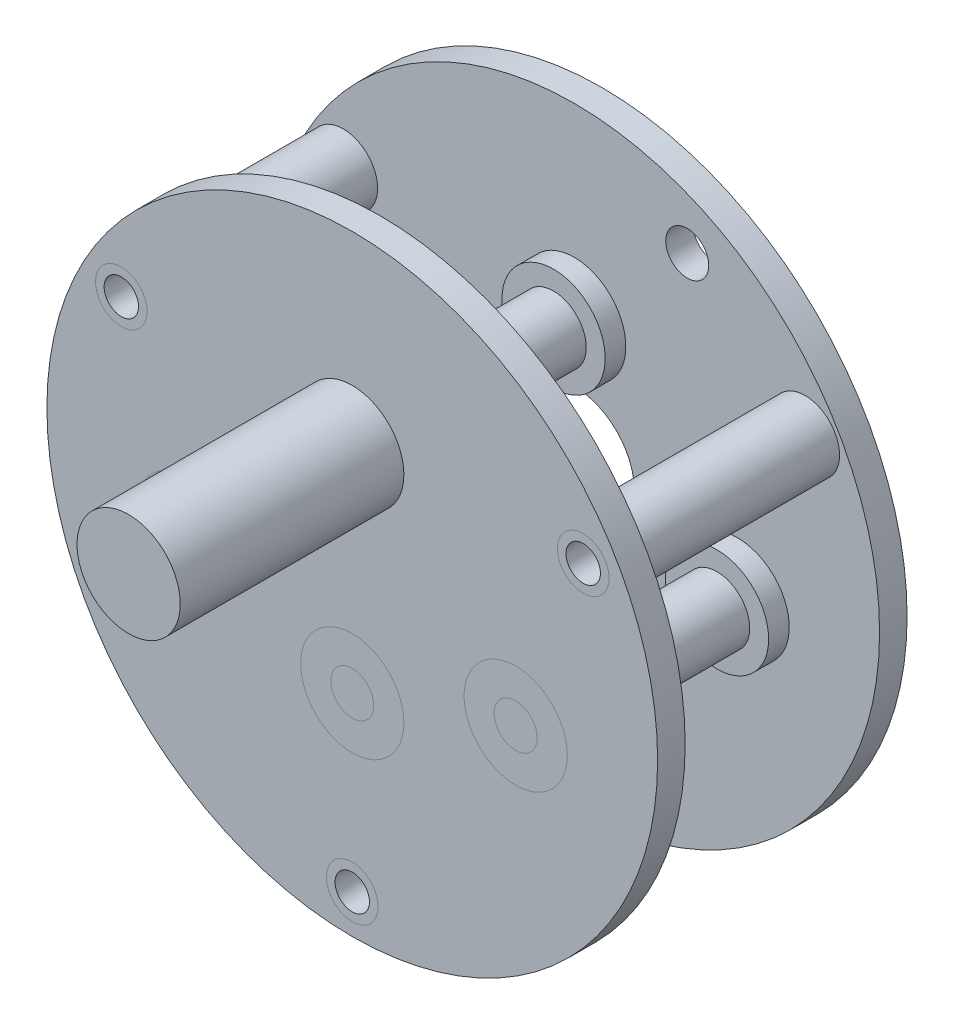
from build123d import *

# Parameters (mm, degrees)
SKETCH_1_R          = 17.75
EXTRUDE_1_DEPTH     = 1.6
SKETCH_2_R          = 2
EXTRUDE_2_DEPTH     = 11.3
EXTRUDE_START       = 1.6
SKETCH_3_R          = 17.75
EXTRUDE_3_DEPTH     = 1.6
CUT_EXTRUDE_2_REACH = 30.989
SKETCH_5_R          = 3.5
SKETCH_5_R_2        = 1
SKETCH_6_R          = 6
EXTRUDE_4_DEPTH     = 10
SKETCH_7_R          = 3
EXTRUDE_5_DEPTH     = 15
CHAMFER_1_SIZE      = 0.5
CUT_EXTRUDE_START   = -12
CUT_EXTRUDE_3_DEPTH = 12
SKETCH_10_R         = 3
EXTRUDE_6_DEPTH     = 2.8
EXTRUDE_7_REACH     = 39.456
SKETCH_13_R         = 1.9
CUT_EXTRUDE_4_REACH = 48.801
CUT_EXTRUDE_5_REACH = 48.801
SKETCH_17_R         = 1.25
CHAMFER_2_SIZE      = 0.5
EXTRUDE_START_2     = 1.2
SKETCH_19_R         = 3
EXTRUDE_8_DEPTH     = 1.2
EXTRUDE_9_REACH     = 39.456
SKETCH_20_R         = 1.9
SKETCH_21_R         = 3
EXTRUDE_10_DEPTH    = 1.2
CUT_EXTRUDE_START_2 = -10
SKETCH_22_R         = 6
SKETCH_22_R_2       = 3
CUT_EXTRUDE_6_DEPTH = 10
SKETCH_24_R         = 3
CUT_EXTRUDE_8_DEPTH = 12


with BuildPart() as part:
    # ｽｹｯﾁ1 → ﾎﾞｽ - 押し出し1 (new body)
    with BuildSketch(Plane.XY):
        Circle(SKETCH_1_R)
    extrude(amount=EXTRUDE_1_DEPTH)

    # ｽｹｯﾁ2 → ﾎﾞｽ - 押し出し2 (add)
    with BuildSketch(Plane(origin=(0, 0, 0), x_dir=(-1, 0, 0), z_dir=(0, 0, -1))):
        with Locations(Location((0, -15.5, 0), (0, 0, 180))):
            Circle(SKETCH_2_R)
        with Locations(Location((-13.423393759, 7.75, 0), (0, 0, 180))):
            Circle(SKETCH_2_R)
        with Locations(Location((13.423393759, 7.75, 0), (0, 0, 180))):
            Circle(SKETCH_2_R)
    extrude(amount=EXTRUDE_2_DEPTH)

    # ｽｹｯﾁ3 → ﾎﾞｽ - 押し出し3 (add)
    with BuildSketch(Plane(origin=(0, 0, -11.3), x_dir=(-1, 0, 0), z_dir=(0, 0, -1)).offset(EXTRUDE_START)):
        with Locations(Location((0, 0, 0), (0, 0, 180))):
            Circle(SKETCH_3_R)
    extrude(amount=-EXTRUDE_3_DEPTH)

    # ｽｹｯﾁ5 → ｶｯﾄ - 押し出し2 (cut, up to next)
    with BuildSketch(Plane(origin=(0, 0, -12.9), x_dir=(-1, 0, 0), z_dir=(0, 0, -1)), mode=Mode.PRIVATE) as cut_extrude_2_sk1:
        Circle(SKETCH_5_R)
    cut_extrude_2_tool1 = extrude(cut_extrude_2_sk1.sketch, amount=-CUT_EXTRUDE_2_REACH, mode=Mode.PRIVATE) & part.part
    # ｽｹｯﾁ5 → ｶｯﾄ - 押し出し2 (cut, up to next)
    with BuildSketch(Plane(origin=(0, 0, -12.9), x_dir=(-1, 0, 0), z_dir=(0, 0, -1)), mode=Mode.PRIVATE) as cut_extrude_2_sk2:
        with Locations((-13.423393759, 7.75)):
            Circle(SKETCH_5_R_2)
    cut_extrude_2_tool2 = extrude(cut_extrude_2_sk2.sketch, amount=-CUT_EXTRUDE_2_REACH, mode=Mode.PRIVATE) & part.part
    # ｽｹｯﾁ5 → ｶｯﾄ - 押し出し2 (cut, up to next)
    with BuildSketch(Plane(origin=(0, 0, -12.9), x_dir=(-1, 0, 0), z_dir=(0, 0, -1)), mode=Mode.PRIVATE) as cut_extrude_2_sk3:
        with Locations((13.423393759, 7.75)):
            Circle(SKETCH_5_R_2)
    cut_extrude_2_tool3 = extrude(cut_extrude_2_sk3.sketch, amount=-CUT_EXTRUDE_2_REACH, mode=Mode.PRIVATE) & part.part
    # ｽｹｯﾁ5 → ｶｯﾄ - 押し出し2 (cut, up to next)
    with BuildSketch(Plane(origin=(0, 0, -12.9), x_dir=(-1, 0, 0), z_dir=(0, 0, -1)), mode=Mode.PRIVATE) as cut_extrude_2_sk4:
        with Locations((0, -15.5)):
            Circle(SKETCH_5_R_2)
    cut_extrude_2_tool4 = extrude(cut_extrude_2_sk4.sketch, amount=-CUT_EXTRUDE_2_REACH, mode=Mode.PRIVATE) & part.part
    add(cut_extrude_2_tool1.solids().sort_by_distance((0, 0, -12.9))[0], mode=Mode.SUBTRACT)
    add(cut_extrude_2_tool2.solids().sort_by_distance((13.423394, 7.75, -12.9))[0], mode=Mode.SUBTRACT)
    add(cut_extrude_2_tool3.solids().sort_by_distance((-13.423394, 7.75, -12.9))[0], mode=Mode.SUBTRACT)
    add(cut_extrude_2_tool4.solids().sort_by_distance((0, -15.5, -12.9))[0], mode=Mode.SUBTRACT)

    # ｽｹｯﾁ6 → ﾎﾞｽ - 押し出し4 (add)
    with BuildSketch(Plane.XY.offset(1.6)):
        with Locations((0, 7)):
            Circle(SKETCH_6_R)
    extrude(amount=EXTRUDE_4_DEPTH)

    # ｽｹｯﾁ7 → ﾎﾞｽ - 押し出し5 (add)
    with BuildSketch(Plane.XY.offset(11.6)):
        with Locations((0, 7)):
            Circle(SKETCH_7_R)
    extrude(amount=EXTRUDE_5_DEPTH)

    # 面取り1
    chamfer_1_edges = [part.edges().sort_by_distance(p)[0] for p in [
        (-3, 7, 26.6),
    ]]
    chamfer(chamfer_1_edges, length=CHAMFER_1_SIZE)

    # ｽｹｯﾁ8 → ｶｯﾄ - 押し出し3 (cut)
    with BuildSketch(Plane.XY.offset(26.6).offset(CUT_EXTRUDE_START)):
        with BuildLine():
            Line((1.658312395, 9.5), (-1.658312395, 9.5))
            ThreePointArc((-1.658312395, 9.5), (0, 10), (1.658312395, 9.5))
        make_face()
    extrude(amount=CUT_EXTRUDE_3_DEPTH, mode=Mode.SUBTRACT)

    # ｽｹｯﾁ10 → ﾎﾞｽ - 押し出し6 (add)
    with BuildSketch(Plane.XY.offset(1.6)):
        with Locations((0, -5.5)):
            Circle(SKETCH_10_R)
        with Locations((9.5, -2.377501001)):
            Circle(SKETCH_10_R)
        with Locations((-9.5, -2.377501001)):
            Circle(SKETCH_10_R)
    extrude_6 = extrude(amount=-EXTRUDE_6_DEPTH)

    # ﾐﾗｰ1: ﾎﾞｽ - 押し出し6 across plane
    add(extrude_6.mirror(Plane.XY.offset(-5.65)))

    # ｽｹｯﾁ13 → ﾎﾞｽ - 押し出し7 (add, up to next)
    with BuildSketch(Plane(origin=(0, 0, -1.2), x_dir=(-1, 0, 0), z_dir=(0, 0, -1)), mode=Mode.PRIVATE) as extrude_7_sk1:
        with Locations(Location((-9.5, -2.377501001, 0), (0, 0, 180))):
            Circle(SKETCH_13_R)
    extrude_7_tool1 = extrude(extrude_7_sk1.sketch, amount=EXTRUDE_7_REACH, mode=Mode.PRIVATE) - part.part
    # ｽｹｯﾁ13 → ﾎﾞｽ - 押し出し7 (add, up to next)
    with BuildSketch(Plane(origin=(0, 0, -1.2), x_dir=(-1, 0, 0), z_dir=(0, 0, -1)), mode=Mode.PRIVATE) as extrude_7_sk2:
        with Locations(Location((0, -5.5, 0), (0, 0, 180))):
            Circle(SKETCH_13_R)
    extrude_7_tool2 = extrude(extrude_7_sk2.sketch, amount=EXTRUDE_7_REACH, mode=Mode.PRIVATE) - part.part
    # ｽｹｯﾁ13 → ﾎﾞｽ - 押し出し7 (add, up to next)
    with BuildSketch(Plane(origin=(0, 0, -1.2), x_dir=(-1, 0, 0), z_dir=(0, 0, -1)), mode=Mode.PRIVATE) as extrude_7_sk3:
        with Locations(Location((9.5, -2.377501001, 0), (0, 0, 180))):
            Circle(SKETCH_13_R)
    extrude_7_tool3 = extrude(extrude_7_sk3.sketch, amount=EXTRUDE_7_REACH, mode=Mode.PRIVATE) - part.part
    add(extrude_7_tool1.solids().sort_by_distance((9.5, -2.377501, -1.2))[0])
    add(extrude_7_tool2.solids().sort_by_distance((0, -5.5, -1.2))[0])
    add(extrude_7_tool3.solids().sort_by_distance((-9.5, -2.377501, -1.2))[0])

    # ｽｹｯﾁ15 → ｶｯﾄ - 押し出し4 (cut, up to next)
    with BuildSketch(Plane(origin=(0, 0, -12.9), x_dir=(-1, 0, 0), z_dir=(0, 0, -1)), mode=Mode.PRIVATE) as cut_extrude_4_sk1:
        with BuildLine():
            Line((2.236067977, -3.5), (-2.236067977, -3.5))
            ThreePointArc((-2.236067977, -3.5), (-1.99347124, -3.258109634), (-1.724878724, -3.045454545))
            ThreePointArc((-1.724878724, -3.045454545), (0, -2.5), (1.724878724, -3.045454545))
            ThreePointArc((1.724878724, -3.045454545), (1.99347124, -3.258109634), (2.236067977, -3.5))
        make_face()
    cut_extrude_4_tool1 = extrude(cut_extrude_4_sk1.sketch, amount=-CUT_EXTRUDE_4_REACH, mode=Mode.PRIVATE) & part.part
    add(cut_extrude_4_tool1.solids().sort_by_distance((0, -3.093671, -12.9))[0], mode=Mode.SUBTRACT)

    # ｽｹｯﾁ17 → ｶｯﾄ - 押し出し5 (cut, up to next)
    with BuildSketch(Plane(origin=(0, 0, -12.9), x_dir=(-1, 0, 0), z_dir=(0, 0, -1)), mode=Mode.PRIVATE) as cut_extrude_5_sk1:
        with Locations((-6.569553896, 13.48484192)):
            Circle(SKETCH_17_R)
    cut_extrude_5_tool1 = extrude(cut_extrude_5_sk1.sketch, amount=-CUT_EXTRUDE_5_REACH, mode=Mode.PRIVATE) & part.part
    # ｽｹｯﾁ17 → ｶｯﾄ - 押し出し5 (cut, up to next)
    with BuildSketch(Plane(origin=(0, 0, -12.9), x_dir=(-1, 0, 0), z_dir=(0, 0, -1)), mode=Mode.PRIVATE) as cut_extrude_5_sk2:
        with Locations((6.569553896, -13.48484192)):
            Circle(SKETCH_17_R)
    cut_extrude_5_tool2 = extrude(cut_extrude_5_sk2.sketch, amount=-CUT_EXTRUDE_5_REACH, mode=Mode.PRIVATE) & part.part
    add(cut_extrude_5_tool1.solids().sort_by_distance((6.569554, 13.484842, -12.9))[0], mode=Mode.SUBTRACT)
    add(cut_extrude_5_tool2.solids().sort_by_distance((-6.569554, -13.484842, -12.9))[0], mode=Mode.SUBTRACT)

    # 面取り2
    chamfer_2_edges = [part.edges().sort_by_distance(p)[0] for p in [
        (-6, 7, 11.6),
    ]]
    chamfer(chamfer_2_edges, length=CHAMFER_2_SIZE)

    # ｽｹｯﾁ19 → ﾎﾞｽ - 押し出し8 (add)
    with BuildSketch(Plane(origin=(0, 0, 0), x_dir=(-1, 0, 0), z_dir=(0, 0, -1)).offset(EXTRUDE_START_2)):
        with Locations(Location((0, 7, 0), (0, 0, 56.442690238))):
            Circle(SKETCH_19_R)
    extrude(amount=-EXTRUDE_8_DEPTH)

    # ｽｹｯﾁ20 → ﾎﾞｽ - 押し出し9 (add, up to next)
    with BuildSketch(Plane(origin=(0, 0, -1.2), x_dir=(-1, 0, 0), z_dir=(0, 0, -1)), mode=Mode.PRIVATE) as extrude_9_sk1:
        with Locations(Location((0, 7, 0), (0, 0, 180))):
            Circle(SKETCH_20_R)
    extrude_9_tool1 = extrude(extrude_9_sk1.sketch, amount=EXTRUDE_9_REACH, mode=Mode.PRIVATE) - part.part
    add(extrude_9_tool1.solids().sort_by_distance((0, 7, -1.2))[0])

    # ｽｹｯﾁ21 → ﾎﾞｽ - 押し出し10 (add)
    with BuildSketch(Plane.XY.offset(-11.3)):
        with Locations(Location((0, 7, 0), (0, 0, 123.557309762))):
            Circle(SKETCH_21_R)
    extrude(amount=EXTRUDE_10_DEPTH)

    # ｽｹｯﾁ22 → ｶｯﾄ - 押し出し6 (cut)
    with BuildSketch(Plane.XY.offset(11.6).offset(CUT_EXTRUDE_START_2)):
        with Locations((0, 7)):
            Circle(SKETCH_22_R)
        with Locations((0, 7)):
            Circle(SKETCH_22_R_2, mode=Mode.SUBTRACT)
    extrude(amount=CUT_EXTRUDE_6_DEPTH, mode=Mode.SUBTRACT)

    # ｽｹｯﾁ24 → ｶｯﾄ - 押し出し8 (cut)
    with BuildSketch(Plane.XY.offset(26.6).offset(CUT_EXTRUDE_START)):
        with Locations((0, 7)):
            Circle(SKETCH_24_R)
    extrude(amount=CUT_EXTRUDE_8_DEPTH, mode=Mode.SUBTRACT)


solid = part.part
